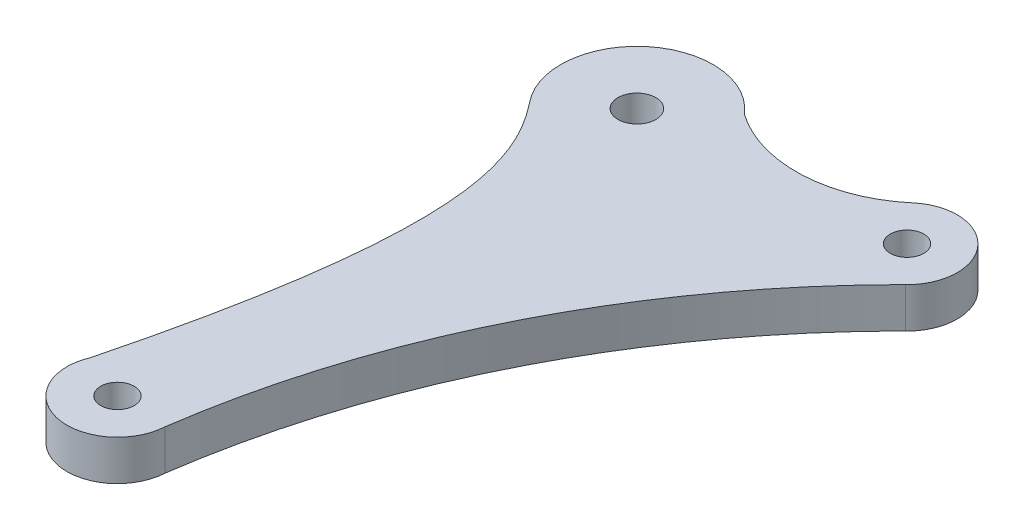
from build123d import *

# Parameters (mm, degrees)
SKETCH1_R           = 1.324438001
SKETCH1_R_2         = 1.324206598
SKETCH1_R_3         = 1.497599193
BOSS_EXTRUDE1_DEPTH = 3.175


with BuildPart() as part:
    # Sketch1 → Boss-Extrude1 (new body)
    with BuildSketch(Plane(origin=(0, 0, 0), x_dir=(1, 0, 0), z_dir=(0, 1, 0))):
        with BuildLine():
            ThreePointArc((-9.665902261, -17.771312034), (-6.897981116, -23.219424369), (-2.001997786, -19.562559221))
            add(Edge.make_bspline(
                [(17.513490591, 19.383376385), (6.94674585, 8.875130126), (0.096552729, -4.795463741), (-2.001997786, -19.562559221)],
                knots=[13, 13, 13, 13, 14, 14, 14, 14], degree=3))
            ThreePointArc((17.513490591, 19.383376385), (17.70603035, 24.895348878), (12.202596033, 25.257458036))
            ThreePointArc((12.202596033, 25.257458036), (5.943668971, 22.793339165), (-0.51448442, 24.674377327))
            ThreePointArc((-0.51448442, 24.674377327), (-8.990035225, 25.434433607), (-9.750091506, 16.958882802))
            add(Edge.make_bspline(
                [(-9.665902261, -17.771312034), (-3.58318049, 6.010156861), (-6.384705359, 12.673352049), (-9.750091506, 16.958882802)],
                knots=[4, 4, 4, 4, 5, 5, 5, 5], degree=3))
        make_face()
        with Locations(Location((-5.989030334, -19.330451358, 0), (0, 0, 270))):
            Circle(SKETCH1_R, mode=Mode.SUBTRACT)
        with Locations(Location((14.767597212, 22.238642776, 0), (0, 0, 270))):
            Circle(SKETCH1_R_2, mode=Mode.SUBTRACT)
        with Locations(Location((-5.132287963, 20.816630064, 0), (0, 0, 270))):
            Circle(SKETCH1_R_3, mode=Mode.SUBTRACT)
    extrude(amount=BOSS_EXTRUDE1_DEPTH)


solid = part.part
